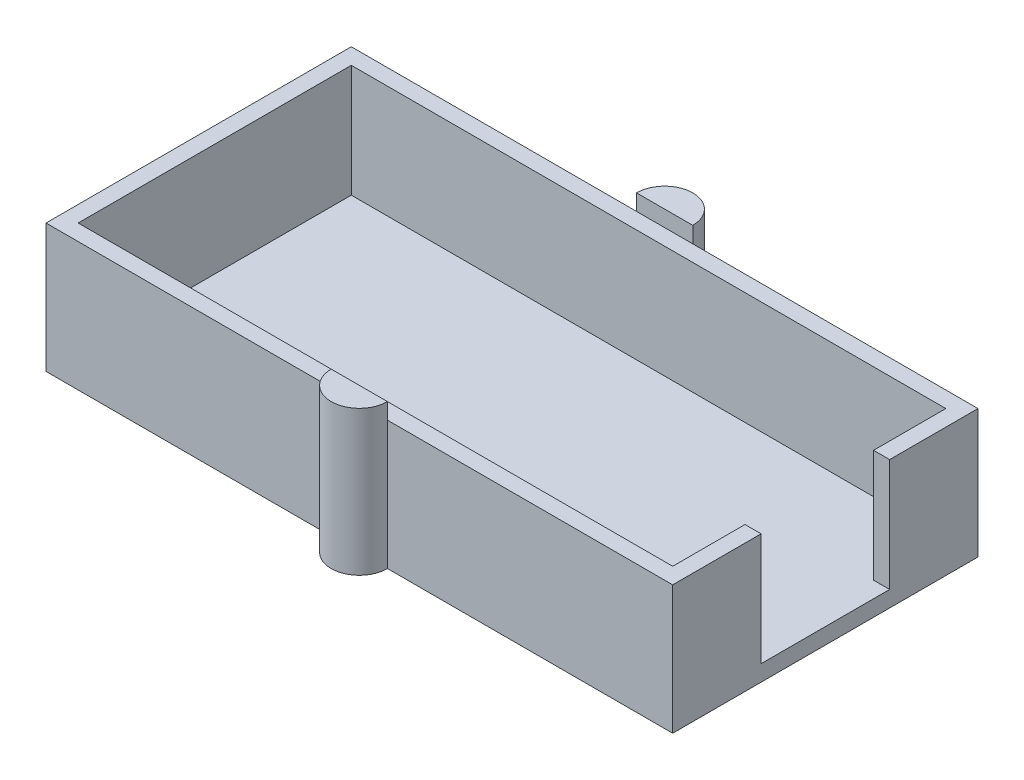
from build123d import *

# Parameters (mm, degrees)
SKETCH1_W           = 39
SKETCH1_H           = 19
SKETCH1_W_2         = 37
SKETCH1_H_2         = 17
BOSS_EXTRUDE1_DEPTH = 7
BOSS_EXTRUDE2_DEPTH = 1
BOSS_EXTRUDE3_START = 8
BOSS_EXTRUDE3_DEPTH = 8
SKETCH4_W           = 8
SKETCH4_H           = 7
CUT_EXTRUDE1_DEPTH  = 8


with BuildPart() as part:
    # Sketch1 → Boss-Extrude1 (new body)
    with BuildSketch(Plane(origin=(0, 0, 0), x_dir=(1, 0, 0), z_dir=(0, 1, 0))):
        with Locations((32.618409138, 12.656662155)):
            Rectangle(SKETCH1_W, SKETCH1_H)
        with Locations((32.618409138, 12.656662155)):
            Rectangle(SKETCH1_W_2, SKETCH1_H_2, mode=Mode.SUBTRACT)
    extrude(amount=BOSS_EXTRUDE1_DEPTH)

    # Sketch2 → Boss-Extrude2 (add)
    with BuildSketch(Plane.XZ):
        with BuildLine():
            Line((13.118409138, -3.156662155), (30.868409138, -3.156662155))
            ThreePointArc((30.868409138, -3.156662155), (32.618409138, -1.406662155), (34.368409138, -3.156662155))
            Line((34.368409138, -3.156662155), (52.118409138, -3.156662155))
            Line((52.118409138, -3.156662155), (52.118409138, -22.156662155))
            Line((52.118409138, -22.156662155), (34.368409138, -22.156662155))
            ThreePointArc((34.368409138, -22.156662155), (32.618409138, -23.906662155), (30.868409138, -22.156662155))
            Line((30.868409138, -22.156662155), (13.118409138, -22.156662155))
            Line((13.118409138, -22.156662155), (13.118409138, -3.156662155))
        make_face()
    extrude(amount=BOSS_EXTRUDE2_DEPTH)

    # Sketch3 → Boss-Extrude3 (add)
    with BuildSketch(Plane(origin=(0, 0, 0), x_dir=(1, 0, 0), z_dir=(0, 1, 0)).offset(BOSS_EXTRUDE3_START)):
        with BuildLine():
            Line((30.868409138, 22.156662155), (34.368409138, 22.156662155))
            ThreePointArc((34.368409138, 22.156662155), (32.618409138, 23.906662155), (30.868409138, 22.156662155))
        make_face()
        with BuildLine():
            Line((30.868409138, 3.156662155), (34.368409138, 3.156662155))
            ThreePointArc((34.368409138, 3.156662155), (32.618409138, 1.406662155), (30.868409138, 3.156662155))
        make_face()
    extrude(amount=-BOSS_EXTRUDE3_DEPTH)

    # Sketch4 → Cut-Extrude1 (cut)
    with BuildSketch(Plane(origin=(52.118409138, 0, 0), x_dir=(0, 0, -1), z_dir=(1, 0, 0))):
        with Locations((12.656662155, 3.5)):
            Rectangle(SKETCH4_W, SKETCH4_H)
    extrude(amount=-CUT_EXTRUDE1_DEPTH, mode=Mode.SUBTRACT)


solid = part.part
